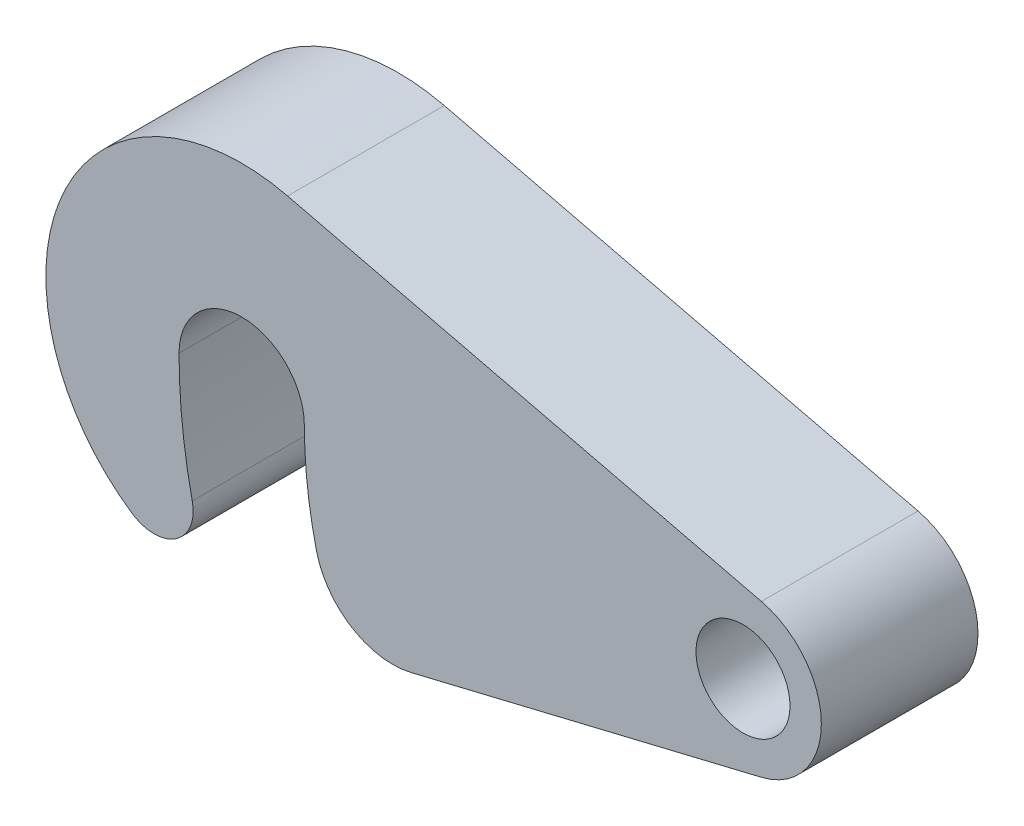
from build123d import *

# Parameters (mm, degrees)
SKETCH1_R           = 6
BOSS_EXTRUDE1_DEPTH = 10


with BuildPart() as part:
    # Sketch1 → Boss-Extrude1 (new, symmetric)
    with BuildSketch(Plane.XY):
        with BuildLine():
            Line((5.859375, 24.30365661), (66.34375, 9.721462644))
            ThreePointArc((66.34375, 9.721462644), (74, 0), (66.34375, -9.721462644))
            Line((66.34375, -9.721462644), (21.625021838, -20.502712644))
            ThreePointArc((21.625021838, -20.502712644), (14.064441198, -19.312643677), (9.559809194, -13.125))
            ThreePointArc((9.559809194, -13.125), (8.391319539, -6.608680461), (8, 0))
            ThreePointArc((8, 0), (0, 8), (-8, 0))
            ThreePointArc((-8, 0), (-7.576881743, -7.794228634), (-6.3125, -15.496849478))
            ThreePointArc((-6.3125, -15.496849478), (-8.385268542, -20.708675871), (-13.994140625, -20.716274476))
            ThreePointArc((-13.994140625, -20.716274476), (-22.874486916, 10.08750952), (5.859375, 24.30365661))
        make_face()
        with Locations((64, 0)):
            Circle(SKETCH1_R, mode=Mode.SUBTRACT)
    extrude(amount=BOSS_EXTRUDE1_DEPTH, both=True)


solid = part.part
